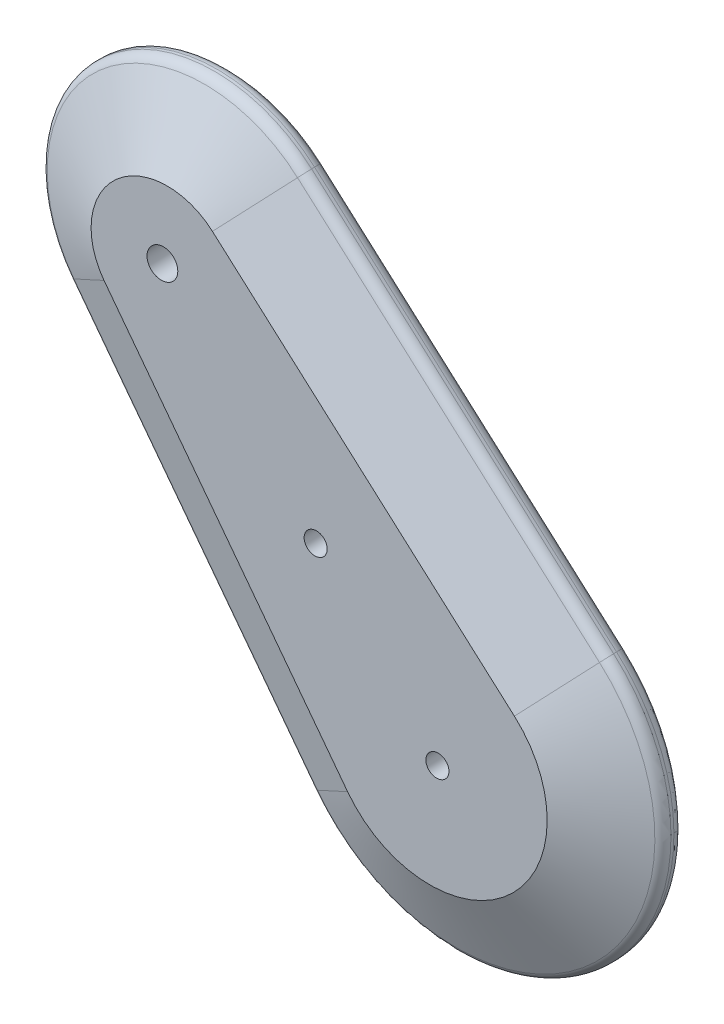
from build123d import *
from OCP.BRepFilletAPI import BRepFilletAPI_MakeChamfer
from build123d.topology import SkipClean

# Parameters (mm, degrees)
SKETCH3_R           = 9.8
BOSS_EXTRUDE1_DEPTH = 5
BOSS_EXTRUDE2_START = -0.5
SKETCH4_R           = 9.8
SKETCH4_R_2         = 2
BOSS_EXTRUDE2_DEPTH = 1.504241
SKETCH5_R           = 2
SKETCH5_R_2         = 1.5
BOSS_EXTRUDE3_DEPTH = 3
CHAMFER1_SIZE       = 1
CHAMFER2_SIZE       = 5
CHAMFER2_SIZE2      = 10.722534603
FILLET2_R           = 1.5
FILLET3_R           = 0.5
FILLET4_R           = 1


with BuildPart() as part:
    # Sketch3 → Boss-Extrude1 (new body)
    with BuildSketch(Plane(origin=(0.992302705, 0.447759341, 19.778908295), x_dir=(0.9987445115277264, -0.0011337468343132525, -0.050081087361986604), z_dir=(0.050093918725163146, 0.022604009769024314, 0.998488686991054))):
        with BuildLine():
            Line((135.489377025, 142.409589945), (168.136309989, 98.002128608))
            ThreePointArc((168.136309989, 98.002128608), (204.84613825, 94.087969855), (205.427714644, 131.001299406))
            Line((205.427714644, 131.001299406), (165.322500749, 168.808926584))
            ThreePointArc((165.322500749, 168.808926584), (138.349498653, 169.233891264), (135.489377025, 142.409589945))
        make_face()
        with Locations(Location((151.603369143, 154.256077104, 0), (0, 0, 0.064975524))):
            Circle(SKETCH3_R, mode=Mode.SUBTRACT)
        with BuildLine():
            Line((168.620347594, 128.900459544), (181.976463063, 108.65294909))
            ThreePointArc((181.976463063, 108.65294909), (193.282136247, 107.156112711), (193.17203439, 118.559912204))
            Line((193.17203439, 118.559912204), (174.700061825, 134.280399778))
            ThreePointArc((174.700061825, 134.280399778), (169.325765337, 134.228511806), (168.620347594, 128.900459544))
        make_face(mode=Mode.SUBTRACT)
    extrude(amount=BOSS_EXTRUDE1_DEPTH)

    # Sketch4 → Boss-Extrude2 (add)
    with SkipClean():  # the faces are left unmerged after this step: merging them gives an invalid solid
        with BuildSketch(Plane(origin=(1.192465921, 0.538079512, 23.768628243), x_dir=(0.9987445115277264, -0.0011337468343132332, -0.05008108736198663), z_dir=(0.050093918725163174, 0.022604009769023943, 0.998488686991054)).offset(BOSS_EXTRUDE2_START)):
            with Locations(Location((151.603369143, 154.256077104, 0), (0, 0, 0.064975524))):
                Circle(SKETCH4_R)
            with Locations(Location((151.603369143, 154.256077104, 0), (0, 0, 0.064975524))):
                Circle(SKETCH4_R_2, mode=Mode.SUBTRACT)
        extrude(amount=BOSS_EXTRUDE2_DEPTH)

    # Sketch5 → Boss-Extrude3 (add)
    with BuildSketch(Plane(origin=(1.242772298, 0.56077939, 24.77135173), x_dir=(0.9987445115277264, -0.0011337468343133737, -0.05008108736198685), z_dir=(0.05009391872516338, 0.022604009769026656, 0.9984886869910538))):
        with BuildLine():
            Line((205.427714644, 131.001299406), (165.322500749, 168.808926584))
            ThreePointArc((165.322500749, 168.808926584), (138.349498653, 169.233891264), (135.489377025, 142.409589945))
            Line((135.489377025, 142.409589945), (168.136309989, 98.002128608))
            ThreePointArc((168.136309989, 98.002128608), (204.84613825, 94.087969855), (205.427714644, 131.001299406))
        make_face()
        with Locations(Location((151.603369143, 154.256077104, 0), (0, 0, 0.064975524))):
            Circle(SKETCH5_R, mode=Mode.SUBTRACT)
        with Locations(Location((188.278800137, 112.810237556, 0), (0, 0, 180.064975524))):
            Circle(SKETCH5_R_2, mode=Mode.SUBTRACT)
        with Locations(Location((172.042808787, 131.158059903, 0), (0, 0, 180.064975524))):
            Circle(SKETCH5_R_2, mode=Mode.SUBTRACT)
    extrude(amount=BOSS_EXTRUDE3_DEPTH)

    # Chamfer1
    chamfer1_edges = [part.edges().sort_by_distance(p)[0] for p in [
        (186.13467409, 150.10430628, 7.102405178),
        (205.581258989, 94.279385266, 7.390552074),
        (152.614546937, 120.450711021, 9.45540598),
        (139.168105157, 169.481448694, 9.020041697),
    ]]
    chamfer(chamfer1_edges, length=CHAMFER1_SIZE)

    # Chamfer2: one chamfer whose edges measure the first distance from different faces: ONE call of the kernel's chamfer builder (chamfer() names one face for all edges)
    chamfer2_edges_1 = [part.edges().sort_by_distance(p)[0] for p in [
        (205.982010339, 94.460217345, 15.37846157),
    ]]
    chamfer2_side_1 = [part.faces().sort_by_distance(p)[0] for p in [
        (205.806681624, 94.38110331, 11.883751166),
    ]]
    chamfer2_edges_2 = [part.edges().sort_by_distance(p)[0] for p in [
        (186.53542544, 150.285138359, 15.090314673),
    ]]
    chamfer2_side_2 = [part.faces().sort_by_distance(p)[0] for p in [
        (186.360096725, 150.206024324, 11.595604269),
    ]]
    chamfer2_edges_3 = [part.edges().sort_by_distance(p)[0] for p in [
        (139.568856507, 169.662280772, 17.007951193),
    ]]
    chamfer2_side_3 = [part.faces().sort_by_distance(p)[0] for p in [
        (139.393527791, 169.583166738, 13.513240789),
    ]]
    chamfer2_edges_4 = [part.edges().sort_by_distance(p)[0] for p in [
        (153.015298286, 120.631543099, 17.443315476),
    ]]
    chamfer2_side_4 = [part.faces().sort_by_distance(p)[0] for p in [
        (152.839969571, 120.552429065, 13.948605072),
    ]]
    chamfer2 = BRepFilletAPI_MakeChamfer(part.part.solid().wrapped)
    for e in chamfer2_edges_1:
        chamfer2.Add(CHAMFER2_SIZE, CHAMFER2_SIZE2, e.wrapped, chamfer2_side_1[0].wrapped)  # the first distance lies on this face
    for e in chamfer2_edges_2:
        chamfer2.Add(CHAMFER2_SIZE, CHAMFER2_SIZE2, e.wrapped, chamfer2_side_2[0].wrapped)  # the first distance lies on this face
    for e in chamfer2_edges_3:
        chamfer2.Add(CHAMFER2_SIZE, CHAMFER2_SIZE2, e.wrapped, chamfer2_side_3[0].wrapped)  # the first distance lies on this face
    for e in chamfer2_edges_4:
        chamfer2.Add(CHAMFER2_SIZE, CHAMFER2_SIZE2, e.wrapped, chamfer2_side_4[0].wrapped)  # the first distance lies on this face
    add(Compound.cast(chamfer2.Shape()), mode=Mode.REPLACE)

    # Fillet2
    fillet2_edges = [part.edges().sort_by_distance(p)[0] for p in [
        (152.664640855, 120.473315031, 10.453894667),
        (205.631352908, 94.301989276, 8.389040761),
        (139.218199076, 169.504052703, 10.018530384),
        (186.184768009, 150.12691029, 8.100893865),
        (152.764828693, 120.51852305, 12.450872041),
        (205.731540745, 94.347197296, 10.386018135),
        (139.318386913, 169.549260723, 12.015507758),
        (186.284955847, 150.17211831, 10.097871238),
    ]]
    fillet(fillet2_edges, radius=FILLET2_R)

    # Fillet3
    fillet3_edges = [part.edges().sort_by_distance(p)[0] for p in [
        (170.355951089, 134.562936532, 13.253416622),
        (176.3210925, 119.108315502, 13.304012184),
        (194.282245052, 107.470311467, 12.666369547),
        (184.947890817, 126.740016435, 12.698439798),
        (142.792761903, 154.571462674, 12.676779171),
    ]]
    fillet(fillet3_edges, radius=FILLET3_R)

    # Fillet4
    fillet4_edges = [part.edges().sort_by_distance(p)[0] for p in [
        (170.105481495, 134.449916484, 8.260973187),
        (176.070622906, 118.995295453, 8.311568749),
        (194.031775458, 107.357291418, 7.673926112),
        (184.697421224, 126.626996387, 7.705996363),
        (142.617645646, 154.492444508, 9.186303567),
    ]]
    fillet(fillet4_edges, radius=FILLET4_R)


solid = part.part
